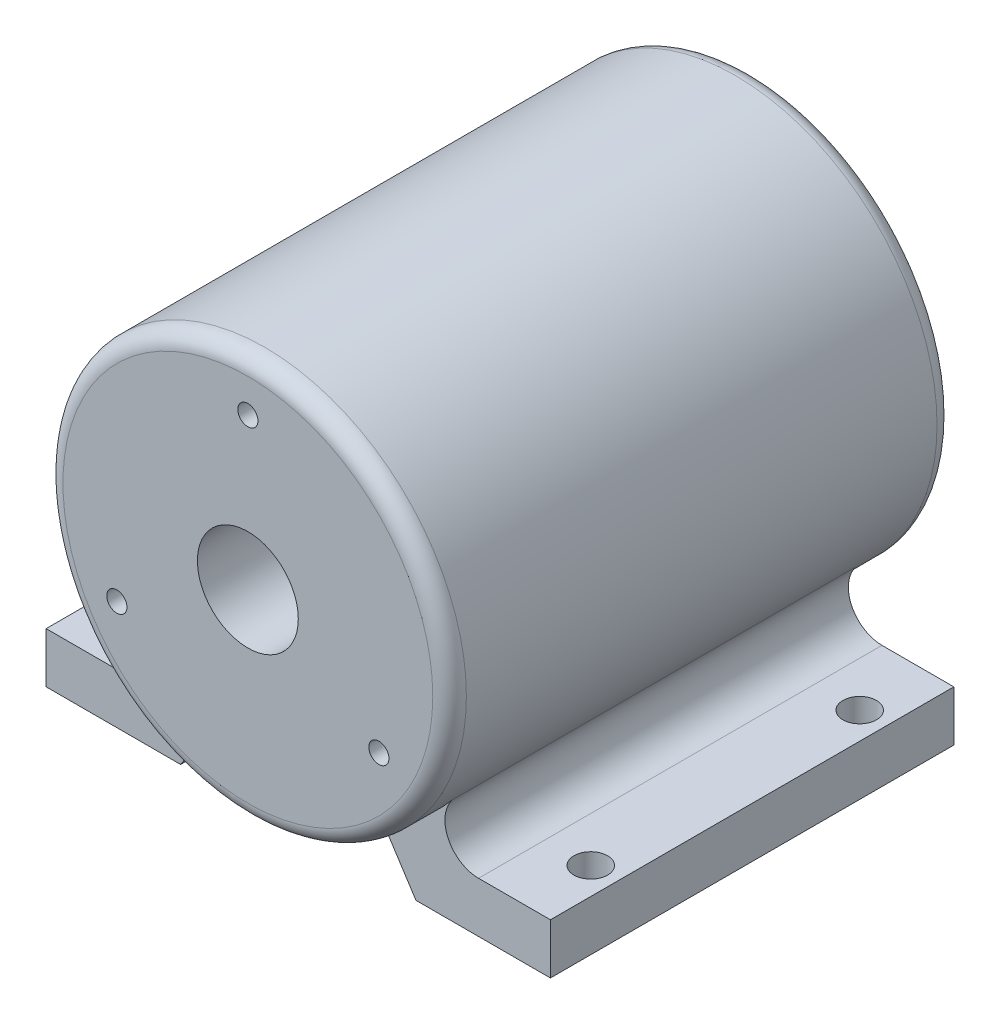
from build123d import *

# Parameters (mm, degrees)
SKETCH_1_R             = 6
EXTRUDE_1_DEPTH        = 15
SKETCH_3_R             = 4
EXTRUDE_3_DEPTH        = 1
FILLET_2_R             = 0.5
EXTRUDE_START          = 7.5
SKETCH_4_W             = 4
SKETCH_4_H             = 1.5
EXTRUDE_4_DEPTH        = 6
F_1_0MM_1_D            = 1
FILLET_3_R             = 0.2
SKETCH_7_R             = 1.5
CUT_EXTRUDE_1_DEPTH    = 20.006577809
HOLE_WIZARD_M2_1_D     = 0.6
HOLE_WIZARD_M2_1_DEPTH = 2.5
HOLE_WIZARD_M2_1_TIP   = 0.180258186


with BuildPart() as part:
    # 草圖1 → 填料-伸長1 (new body)
    with BuildSketch(Plane.XY):
        Circle(SKETCH_1_R)
    extrude(amount=EXTRUDE_1_DEPTH)

    # 草圖3 → 填料-伸長3 (add)
    with BuildSketch(Plane(origin=(0, 0, 0), x_dir=(-1, 0, 0), z_dir=(0, 0, -1))):
        Circle(SKETCH_3_R)
    extrude(amount=EXTRUDE_3_DEPTH)

    # 圓角2
    fillet_2_edges = [part.edges().sort_by_distance(p)[0] for p in [
        (-6, 0, 0),
        (-6, 0, 15),
    ]]
    fillet(fillet_2_edges, radius=FILLET_2_R)

    # 草圖4 → 填料-伸長4 (add, symmetric)
    with BuildSketch(Plane.XY.offset(EXTRUDE_START)):
        with Locations((5.5, -6.25)):
            Rectangle(SKETCH_4_W, SKETCH_4_H)
        with BuildLine():
            Line((2.5, -5.454356057), (3.5, -7))
            Line((3.5, -7), (3.5, -5.5))
            Line((3.5, -5.5), (5.361902647, -5.5))
            ThreePointArc((5.361902647, -5.5), (4.45557568, -4.922577127), (4.595916555, -3.857142857))
            ThreePointArc((4.595916555, -3.857142857), (3.636726611, -4.772234231), (2.5, -5.454356057))
        make_face()
    extrude_4 = extrude(amount=EXTRUDE_4_DEPTH, both=True)

    # Ø1.0mm 定位孔1 (through all)
    with Locations(Plane(origin=(0, -5.5, 0), x_dir=(1, 0, 0), z_dir=(0, 1, 0))):
        with Locations((6.7, -3.5), (6.7, -11.5)):
            f_1_0mm_1 = Hole(F_1_0MM_1_D / 2)

    # 鏡射1: 填料-伸長4, Ø1.0mm 定位孔1 across plane
    add(extrude_4.mirror(Plane(origin=(0, 0, 0), x_dir=(0, 0, 1), z_dir=(1, 0, 0))))
    add(f_1_0mm_1.mirror(Plane(origin=(0, 0, 0), x_dir=(0, 0, 1), z_dir=(1, 0, 0))), mode=Mode.SUBTRACT)

    # 圓角3
    fillet_3_edges = [part.edges().sort_by_distance(p)[0] for p in [
        (4, 0, 0),
        (4, 0, -1),
    ]]
    fillet(fillet_3_edges, radius=FILLET_3_R)

    # 草圖7 → 除料-伸長1 (cut, through all)
    with BuildSketch(Plane.XY.offset(15)):
        Circle(SKETCH_7_R)
    extrude(amount=-CUT_EXTRUDE_1_DEPTH, mode=Mode.SUBTRACT)

    # M2 螺紋孔1
    with Locations(Plane.XY.offset(15)):
        with Locations((0, 4.5), (3.897114317, -2.25), (-3.897114317, -2.25)):
            Hole(HOLE_WIZARD_M2_1_D / 2, depth=HOLE_WIZARD_M2_1_DEPTH)
            with Locations((0, 0, -(HOLE_WIZARD_M2_1_DEPTH + HOLE_WIZARD_M2_1_TIP / 2))):  # 118° drill point
                Cone(0, HOLE_WIZARD_M2_1_D / 2, HOLE_WIZARD_M2_1_TIP, mode=Mode.SUBTRACT)


solid = part.part
